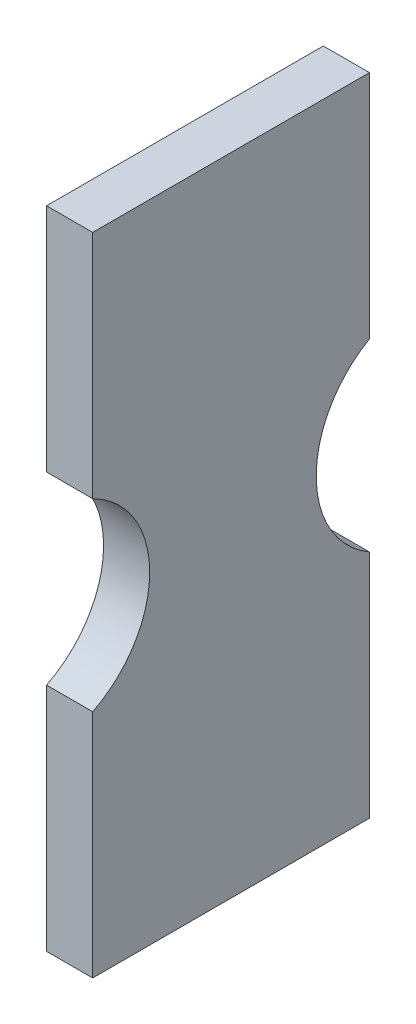
from build123d import *

# Parameters (mm, degrees)
SKETCH1_W           = 88.9
SKETCH1_H           = 38.1
BOSS_EXTRUDE1_DEPTH = 6.35
CUT_EXTRUDE2_DEPTH  = 6.35


with BuildPart() as part:
    # Sketch1 → Boss-Extrude1 (new body)
    with BuildSketch(Plane.YZ):
        with Locations((44.45, 19.05)):
            Rectangle(SKETCH1_W, SKETCH1_H)
    extrude(amount=BOSS_EXTRUDE1_DEPTH)

    # Sketch2 → Cut-Extrude2 (cut)
    with BuildSketch(Plane.YZ.offset(6.35)):
        with BuildLine():
            Line((31.75, 38.1), (57.15, 38.1))
            ThreePointArc((57.15, 38.1), (44.45, 30.250968343), (31.75, 38.1))
        make_face()
        with BuildLine():
            Line((31.75, 0), (57.15, 0))
            ThreePointArc((57.15, 0), (44.45, 7.326494526), (31.75, 0))
        make_face()
    extrude(amount=-CUT_EXTRUDE2_DEPTH, mode=Mode.SUBTRACT)


solid = part.part
